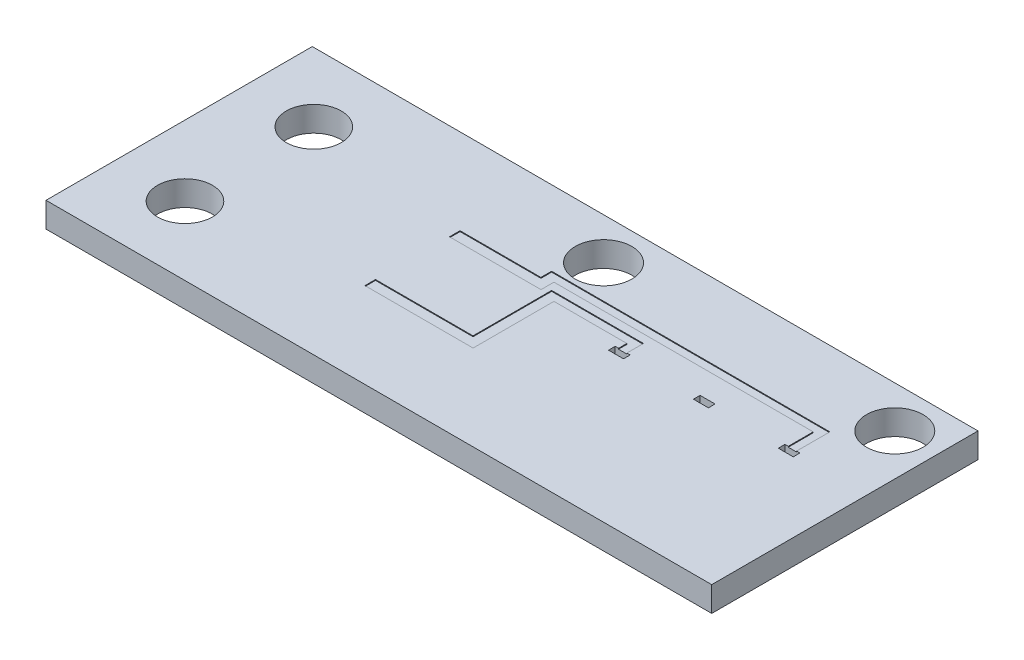
from build123d import *

# Parameters (mm, degrees)
SKETCH1_W           = 40
SKETCH1_H           = 16
BOSS_EXTRUDE1_DEPTH = 1.5
SKETCH2_R           = 1.7
CUT_EXTRUDE1_DEPTH  = 22.592822882
SKETCH3_W           = 0.9
SKETCH3_H           = 0.4
CUT_EXTRUDE2_DEPTH  = 22.592822882
SKETCH5_R           = 1.65
CUT_EXTRUDE4_DEPTH  = 22.592822882
CUT_EXTRUDE5_DEPTH  = 0.05


with BuildPart() as part:
    # Sketch1 → Boss-Extrude1 (new body)
    with BuildSketch(Plane(origin=(0, 0, 0), x_dir=(1, 0, 0), z_dir=(0, 1, 0))):
        Rectangle(SKETCH1_W, SKETCH1_H)
    extrude(amount=BOSS_EXTRUDE1_DEPTH)

    # Sketch2 → Cut-Extrude1 (cut, through all)
    with BuildSketch(Plane(origin=(0, 1.5, 0), x_dir=(1, 0, 0), z_dir=(0, 1, 0))):
        with Locations(Location((0, 5.5, 0), (0, 0, 270))):
            Circle(SKETCH2_R)
        with Locations(Location((17.5, 5.5, 0), (0, 0, 270))):
            Circle(SKETCH2_R)
    extrude(amount=-CUT_EXTRUDE1_DEPTH, mode=Mode.SUBTRACT)

    # Sketch3 → Cut-Extrude2 (cut, through all)
    with BuildSketch(Plane(origin=(0, 1.5, 0), x_dir=(1, 0, 0), z_dir=(0, 1, 0))):
        with Locations((15.35, 1.3)):
            Rectangle(SKETCH3_W, SKETCH3_H)
        with Locations((5.15, 1.3)):
            Rectangle(SKETCH3_W, SKETCH3_H)
        with Locations((10.25, 1.3)):
            Rectangle(SKETCH3_W, SKETCH3_H)
    extrude(amount=-CUT_EXTRUDE2_DEPTH, mode=Mode.SUBTRACT)

    # Sketch5 → Cut-Extrude4 (cut, through all)
    with BuildSketch(Plane(origin=(0, 1.5, 0), x_dir=(1, 0, 0), z_dir=(0, 1, 0))):
        with Locations(Location((-15.78, 3.87, 0), (0, 0, 270))):
            Circle(SKETCH5_R)
        with Locations(Location((-15.78, -3.87, 0), (0, 0, 270))):
            Circle(SKETCH5_R)
    extrude(amount=-CUT_EXTRUDE4_DEPTH, mode=Mode.SUBTRACT)

    # Sketch6 → Cut-Extrude5 (cut)
    with BuildSketch(Plane(origin=(0, 1.5, 0), x_dir=(1, 0, 0), z_dir=(0, 1, 0))):
        Polygon((4.9, 1.5), (4.9, 2), (0.5208, 2), (0.5208, -2.8575), (-5.9792, -2.8575), (-5.9792, -2.2225), (-0.1192, -2.2225), (-0.1192, 2.5), (5.4, 2.5), (5.4, 1.5), align=None)
        Polygon((-5.9792, 2.8575), (-5.9792, 2.2225), (-0.4792, 2.2225), (-0.4792, 3), (15.1, 3), (15.1, 1.5), (15.6, 1.5), (15.6, 3.5), (-1.1192, 3.5), (-1.1192, 2.8575), align=None)
    extrude(amount=-CUT_EXTRUDE5_DEPTH, mode=Mode.SUBTRACT)


solid = part.part
